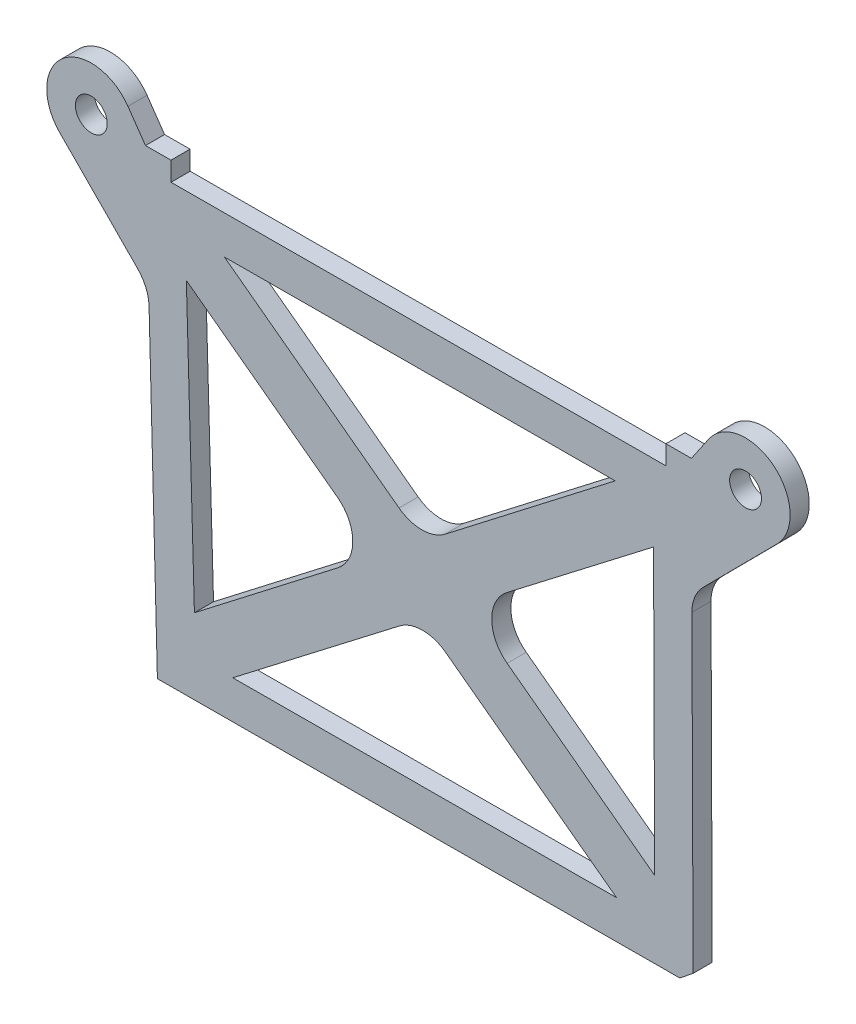
from build123d import *

# Parameters (mm, degrees)
SKETCH_1_R      = 1.25
EXTRUDE_1_DEPTH = 1.5


with BuildPart() as part:
    # 草图1 → 凸台-拉伸1 (new body)
    with BuildSketch(Plane.XY):
        with BuildLine():
            Line((61.485606927, 36.379045593), (55.661903622, 30.510449214))
            ThreePointArc((55.661903622, 30.510449214), (55.015327208, 29.534689328), (54.791375635, 28.385770659))
            Line((54.791375635, 28.385770659), (54.885447805, 3.885951263))
            Line((54.885447805, 3.885951263), (53.839506367, 3.049659841))
            Line((53.839506367, 3.049659841), (12.839808602, 2.892232945))
            Line((12.839808602, 2.892232945), (12.184344201, 27.942846038))
            ThreePointArc((12.184344201, 27.942846038), (11.926294769, 29.05242031), (11.284734435, 29.993773012))
            Line((11.284734435, 29.993773012), (6.389951155, 34.947075309))
            Line((6.389951155, 34.947075309), (5.188508902, 36.162881267))
            ThreePointArc((5.188508902, 36.162881267), (5.404097854, 41.328389075), (10.528570268, 40.643749035))
            Line((10.528570268, 40.643749035), (11.903832696, 38.663553725))
            Line((11.903832696, 38.663553725), (13.903817953, 38.671233086))
            Line((13.903817953, 38.671233086), (13.909577473, 37.171244144))
            Line((13.909577473, 37.171244144), (52.757056868, 37.320407148))
            Line((52.757056868, 37.320407148), (52.751297347, 38.820396091))
            Line((52.751297347, 38.820396091), (54.751282604, 38.828075452))
            Line((54.751282604, 38.828075452), (56.111289997, 40.818768719))
            ThreePointArc((56.111289997, 40.818768719), (61.230354838, 41.542747399), (61.485606927, 36.379045593))
        make_face()
        with Locations((59.00124888, 38.844398528)):
            Circle(SKETCH_1_R, mode=Mode.SUBTRACT)
        with Locations((7.653861631, 38.647239518)):
            Circle(SKETCH_1_R, mode=Mode.SUBTRACT)
        with BuildLine():
            Line((35.427528313, 24.013077802), (48.768603001, 34.305074976))
            Line((48.768603001, 34.305074976), (18.099515168, 34.187314613))
            Line((18.099515168, 34.187314613), (31.803272227, 23.982277822))
            ThreePointArc((31.803272227, 23.982277822), (33.620577188, 23.388506116), (35.427528313, 24.013077802))
        make_face(mode=Mode.SUBTRACT)
        with BuildLine():
            Line((40.287692252, 17.664023775), (51.865627723, 9.042062882))
            Line((51.865627723, 9.042062882), (51.780099927, 31.316616132))
            Line((51.780099927, 31.316616132), (40.250425641, 22.448057755))
            ThreePointArc((40.250425641, 22.448057755), (39.07959428, 20.046775087), (40.287692252, 17.664023775))
        make_face(mode=Mode.SUBTRACT)
        with BuildLine():
            Line((26.964065744, 22.301778302), (15.112244568, 31.102127061))
            Line((15.112244568, 31.102127061), (15.745126999, 8.829052268))
            Line((15.745126999, 8.829052268), (27.00804452, 17.517851185))
            ThreePointArc((27.00804452, 17.517851185), (28.175472686, 19.920749093), (26.964065744, 22.301778302))
        make_face(mode=Mode.SUBTRACT)
        with BuildLine():
            Line((48.877230949, 6.030566195), (35.448021091, 16.002175498))
            ThreePointArc((35.448021091, 16.002175498), (33.634102155, 16.593460395), (31.83047717, 15.971482382))
            Line((31.83047717, 15.971482382), (18.755497751, 5.914284289))
            Line((18.755497751, 5.914284289), (48.877230949, 6.030566195))
        make_face(mode=Mode.SUBTRACT)
    extrude(amount=EXTRUDE_1_DEPTH)


solid = part.part
